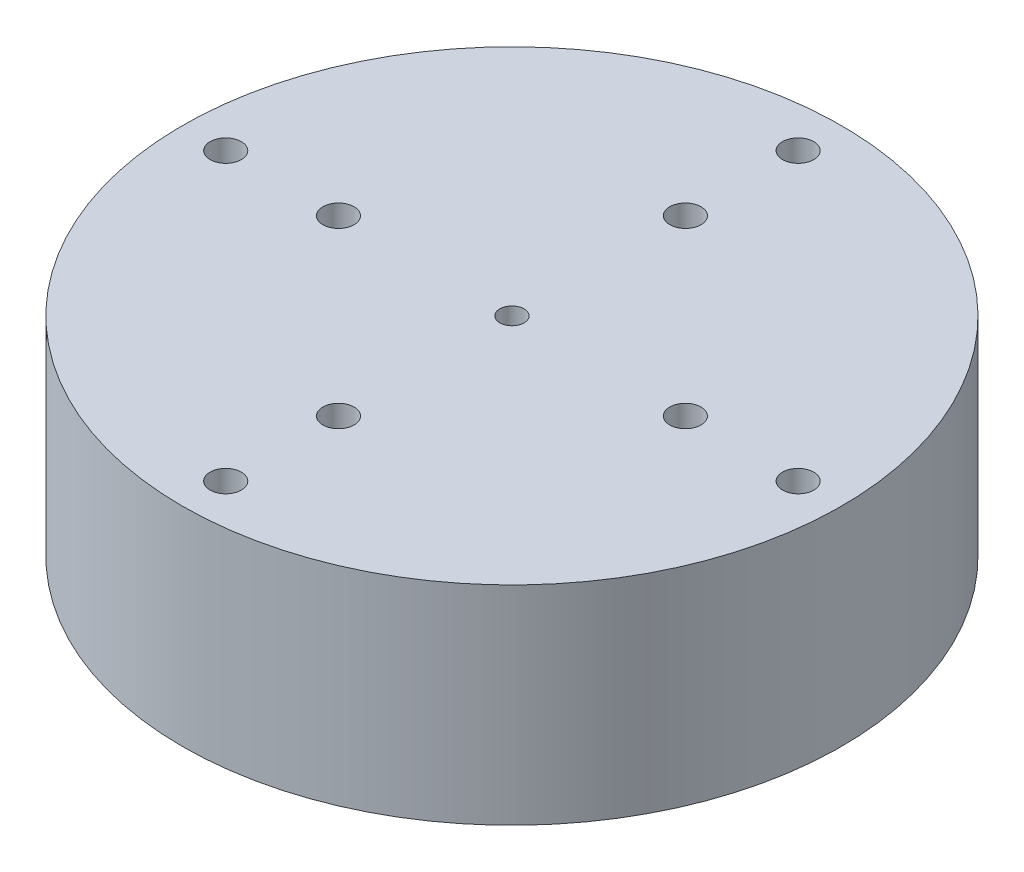
from build123d import *

# Parameters (mm, degrees)
SKETCH1_R           = 47.5
SKETCH1_R_2         = 35
BOSS_EXTRUDE1_DEPTH = 30
SKETCH2_R           = 2.25
CUT_EXTRUDE1_DEPTH  = 74.569694848
BOSS_EXTRUDE2_START = -15
SKETCH4_R           = 35
BOSS_EXTRUDE2_DEPTH = 15
SKETCH6_R           = 1.75
CUT_EXTRUDE2_DEPTH  = 30
SKETCH2_2_R         = 2.25
CUT_EXTRUDE3_DEPTH  = 74.569694848


with BuildPart() as part:
    # Sketch1 → Boss-Extrude1 (new body)
    with BuildSketch(Plane(origin=(0, 0, 0), x_dir=(1, 0, 0), z_dir=(0, 1, 0))):
        Circle(SKETCH1_R)
        Circle(SKETCH1_R_2, mode=Mode.SUBTRACT)
    extrude(amount=BOSS_EXTRUDE1_DEPTH)

    # Sketch2 → Cut-Extrude1 (cut, through all)
    with BuildSketch(Plane(origin=(0, 30, 0), x_dir=(1, 0, 0), z_dir=(0, 1, 0))):
        with Locations((0, 41.25)):
            Circle(SKETCH2_R)
        with Locations((41.25, 0)):
            Circle(SKETCH2_R)
        with Locations((0, -41.25)):
            Circle(SKETCH2_R)
        with Locations((-41.25, 0)):
            Circle(SKETCH2_R)
        with Locations((0, 25)):
            Circle(SKETCH2_R)
        with Locations((25, 0)):
            Circle(SKETCH2_R)
        with Locations((0, -25)):
            Circle(SKETCH2_R)
        with Locations((-25, 0)):
            Circle(SKETCH2_R)
    extrude(amount=-CUT_EXTRUDE1_DEPTH, mode=Mode.SUBTRACT)

    # Sketch4 → Boss-Extrude2 (add)
    with BuildSketch(Plane(origin=(0, 30, 0), x_dir=(1, 0, 0), z_dir=(0, 1, 0)).offset(BOSS_EXTRUDE2_START)):
        Circle(SKETCH4_R)
    extrude(amount=BOSS_EXTRUDE2_DEPTH)

    # Sketch6 → Cut-Extrude2 (cut)
    with BuildSketch(Plane(origin=(0, 30, 0), x_dir=(1, 0, 0), z_dir=(0, 1, 0))):
        Circle(SKETCH6_R)
    extrude(amount=-CUT_EXTRUDE2_DEPTH, mode=Mode.SUBTRACT)

    # Sketch2<2> → Cut-Extrude3 (cut, through all)
    with BuildSketch(Plane(origin=(0, 30, 0), x_dir=(1, 0, 0), z_dir=(0, 1, 0))):
        with Locations((0, 41.25)):
            Circle(SKETCH2_2_R)
        with Locations((41.25, 0)):
            Circle(SKETCH2_2_R)
        with Locations((0, -41.25)):
            Circle(SKETCH2_2_R)
        with Locations((-41.25, 0)):
            Circle(SKETCH2_2_R)
        with Locations((0, 25)):
            Circle(SKETCH2_2_R)
        with Locations((25, 0)):
            Circle(SKETCH2_2_R)
        with Locations((0, -25)):
            Circle(SKETCH2_2_R)
        with Locations((-25, 0)):
            Circle(SKETCH2_2_R)
    extrude(amount=-CUT_EXTRUDE3_DEPTH, mode=Mode.SUBTRACT)


solid = part.part
